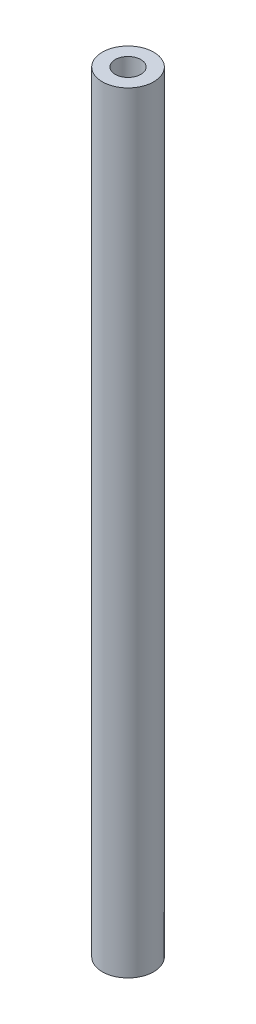
from build123d import *

# Parameters (mm, degrees)
SKETCH_1_R      = 3
SKETCH_1_R_2    = 1.5
EXTRUDE_1_DEPTH = 90


with BuildPart() as part:
    # 草图1 → 凸台-拉伸1 (new body)
    with BuildSketch(Plane(origin=(0, 0, 0), x_dir=(1, 0, 0), z_dir=(0, 1, 0))):
        with Locations(Location((0, 0, 0), (0, 0, 90))):
            Circle(SKETCH_1_R)
        with Locations(Location((0, 0, 0), (0, 0, 90))):
            Circle(SKETCH_1_R_2, mode=Mode.SUBTRACT)
    extrude(amount=EXTRUDE_1_DEPTH)


solid = part.part
